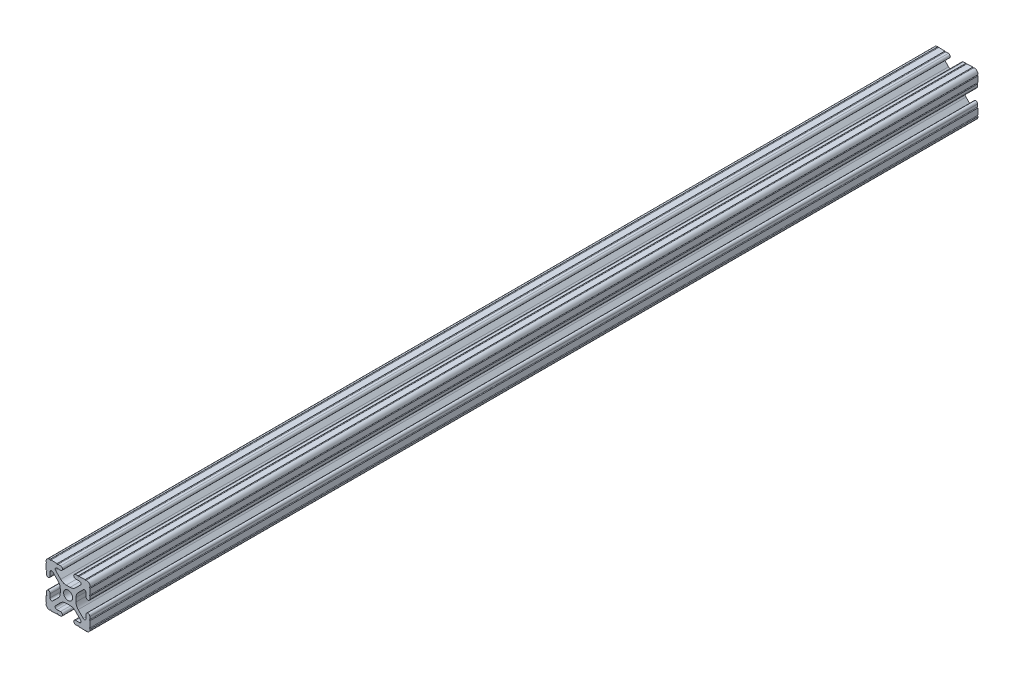
from build123d import *

# Parameters (mm, degrees)
SKETCH3_R      = 2.6035
EXTRUDE1_DEPTH = 255.025


with BuildPart() as part:
    # Sketch3 → Extrude1 (new, symmetric)
    with BuildSketch(Plane.XY):
        with BuildLine():
            Line((-1.115277175, 4.5085), (1.115277175, 4.5085))
            ThreePointArc((1.115277175, 4.5085), (2.806584872, 4.844922018), (4.240406305, 5.80297087))
            Line((4.240406305, 5.80297087), (7.148423664, 8.710988229))
            ThreePointArc((7.148423664, 8.710988229), (7.349906316, 9.772227925), (6.436353897, 10.348636575))
            Line((6.436353897, 10.348636575), (4.381960454, 10.276895575))
            ThreePointArc((4.381960454, 10.276895575), (3.239173075, 11.342562046), (4.304839546, 12.485349424))
            Line((4.304839546, 12.485349424), (5.728246175, 12.535055879))
            ThreePointArc((5.728246175, 12.535055879), (6.054756855, 12.230579745), (6.35923299, 12.557090424))
            Line((6.35923299, 12.557090424), (9.782092278, 12.676619304))
            ThreePointArc((9.782092278, 12.676619304), (10.108602958, 12.37214317), (10.413079092, 12.69865385))
            ThreePointArc((10.413079092, 12.69865385), (12.052764565, 12.052764565), (12.69865385, 10.413079092))
            ThreePointArc((12.69865385, 10.413079092), (12.37214317, 10.108602958), (12.676619304, 9.782092278))
            Line((12.676619304, 9.782092278), (12.557090424, 6.35923299))
            ThreePointArc((12.557090424, 6.35923299), (12.230579745, 6.054756855), (12.535055879, 5.728246175))
            Line((12.535055879, 5.728246175), (12.485349424, 4.304839546))
            ThreePointArc((12.485349424, 4.304839546), (11.342562046, 3.239173075), (10.276895575, 4.381960454))
            Line((10.276895575, 4.381960454), (10.348636575, 6.436353897))
            ThreePointArc((10.348636575, 6.436353897), (9.772227925, 7.349906316), (8.710988229, 7.148423664))
            Line((8.710988229, 7.148423664), (5.80297087, 4.240406305))
            ThreePointArc((5.80297087, 4.240406305), (4.844922018, 2.806584872), (4.5085, 1.115277175))
            Line((4.5085, 1.115277175), (4.5085, -1.115277175))
            ThreePointArc((4.5085, -1.115277175), (4.844922018, -2.806584872), (5.80297087, -4.240406305))
            Line((5.80297087, -4.240406305), (8.710988229, -7.148423664))
            ThreePointArc((8.710988229, -7.148423664), (9.772227925, -7.349906316), (10.348636575, -6.436353897))
            Line((10.348636575, -6.436353897), (10.276895575, -4.381960454))
            ThreePointArc((10.276895575, -4.381960454), (11.342562046, -3.239173075), (12.485349424, -4.304839546))
            Line((12.485349424, -4.304839546), (12.535055879, -5.728246175))
            ThreePointArc((12.535055879, -5.728246175), (12.230579745, -6.054756855), (12.557090424, -6.35923299))
            Line((12.557090424, -6.35923299), (12.676619304, -9.782092278))
            ThreePointArc((12.676619304, -9.782092278), (12.37214317, -10.108602958), (12.69865385, -10.413079092))
            ThreePointArc((12.69865385, -10.413079092), (12.052764565, -12.052764565), (10.413079092, -12.69865385))
            ThreePointArc((10.413079092, -12.69865385), (10.108602958, -12.37214317), (9.782092278, -12.676619304))
            Line((9.782092278, -12.676619304), (6.35923299, -12.557090424))
            ThreePointArc((6.35923299, -12.557090424), (6.054756855, -12.230579745), (5.728246175, -12.535055879))
            Line((5.728246175, -12.535055879), (4.304839546, -12.485349424))
            ThreePointArc((4.304839546, -12.485349424), (3.239173075, -11.342562046), (4.381960454, -10.276895575))
            Line((4.381960454, -10.276895575), (6.436353897, -10.348636575))
            ThreePointArc((6.436353897, -10.348636575), (7.349906316, -9.772227925), (7.148423664, -8.710988229))
            Line((7.148423664, -8.710988229), (4.240406305, -5.80297087))
            ThreePointArc((4.240406305, -5.80297087), (2.806584872, -4.844922018), (1.115277175, -4.5085))
            Line((1.115277175, -4.5085), (-1.115277175, -4.5085))
            ThreePointArc((-1.115277175, -4.5085), (-2.806584872, -4.844922018), (-4.240406305, -5.80297087))
            Line((-4.240406305, -5.80297087), (-7.148423664, -8.710988229))
            ThreePointArc((-7.148423664, -8.710988229), (-7.349906316, -9.772227925), (-6.436353897, -10.348636575))
            Line((-6.436353897, -10.348636575), (-4.381960454, -10.276895575))
            ThreePointArc((-4.381960454, -10.276895575), (-3.239173075, -11.342562046), (-4.304839546, -12.485349424))
            Line((-4.304839546, -12.485349424), (-5.728246175, -12.535055879))
            ThreePointArc((-5.728246175, -12.535055879), (-6.054756855, -12.230579745), (-6.35923299, -12.557090424))
            Line((-6.35923299, -12.557090424), (-9.782092278, -12.676619304))
            ThreePointArc((-9.782092278, -12.676619304), (-10.108602958, -12.37214317), (-10.413079092, -12.69865385))
            ThreePointArc((-10.413079092, -12.69865385), (-12.052764565, -12.052764565), (-12.69865385, -10.413079092))
            ThreePointArc((-12.69865385, -10.413079092), (-12.37214317, -10.108602958), (-12.676619304, -9.782092278))
            Line((-12.676619304, -9.782092278), (-12.557090424, -6.35923299))
            ThreePointArc((-12.557090424, -6.35923299), (-12.230579745, -6.054756855), (-12.535055879, -5.728246175))
            Line((-12.535055879, -5.728246175), (-12.485349424, -4.304839546))
            ThreePointArc((-12.485349424, -4.304839546), (-11.342562046, -3.239173075), (-10.276895575, -4.381960454))
            Line((-10.276895575, -4.381960454), (-10.348636575, -6.436353897))
            ThreePointArc((-10.348636575, -6.436353897), (-9.772227925, -7.349906316), (-8.710988229, -7.148423664))
            Line((-8.710988229, -7.148423664), (-5.80297087, -4.240406305))
            ThreePointArc((-5.80297087, -4.240406305), (-4.844922018, -2.806584872), (-4.5085, -1.115277175))
            Line((-4.5085, -1.115277175), (-4.5085, 1.115277175))
            ThreePointArc((-4.5085, 1.115277175), (-4.844922018, 2.806584872), (-5.80297087, 4.240406305))
            Line((-5.80297087, 4.240406305), (-8.710988229, 7.148423664))
            ThreePointArc((-8.710988229, 7.148423664), (-9.772227925, 7.349906316), (-10.348636575, 6.436353897))
            Line((-10.348636575, 6.436353897), (-10.276895575, 4.381960454))
            ThreePointArc((-10.276895575, 4.381960454), (-11.342562046, 3.239173075), (-12.485349424, 4.304839546))
            Line((-12.485349424, 4.304839546), (-12.535055879, 5.728246175))
            ThreePointArc((-12.535055879, 5.728246175), (-12.230579745, 6.054756855), (-12.557090424, 6.35923299))
            Line((-12.557090424, 6.35923299), (-12.676619304, 9.782092278))
            ThreePointArc((-12.676619304, 9.782092278), (-12.37214317, 10.108602958), (-12.69865385, 10.413079092))
            ThreePointArc((-12.69865385, 10.413079092), (-12.052764565, 12.052764565), (-10.413079092, 12.69865385))
            ThreePointArc((-10.413079092, 12.69865385), (-10.108602958, 12.37214317), (-9.782092278, 12.676619304))
            Line((-9.782092278, 12.676619304), (-6.35923299, 12.557090424))
            ThreePointArc((-6.35923299, 12.557090424), (-6.054756855, 12.230579745), (-5.728246175, 12.535055879))
            Line((-5.728246175, 12.535055879), (-4.304839546, 12.485349424))
            ThreePointArc((-4.304839546, 12.485349424), (-3.239173075, 11.342562046), (-4.381960454, 10.276895575))
            Line((-4.381960454, 10.276895575), (-6.436353897, 10.348636575))
            ThreePointArc((-6.436353897, 10.348636575), (-7.349906316, 9.772227925), (-7.148423664, 8.710988229))
            Line((-7.148423664, 8.710988229), (-4.240406305, 5.80297087))
            ThreePointArc((-4.240406305, 5.80297087), (-2.806584872, 4.844922018), (-1.115277175, 4.5085))
        make_face()
        Circle(SKETCH3_R, mode=Mode.SUBTRACT)
    extrude(amount=EXTRUDE1_DEPTH, both=True)


solid = part.part
